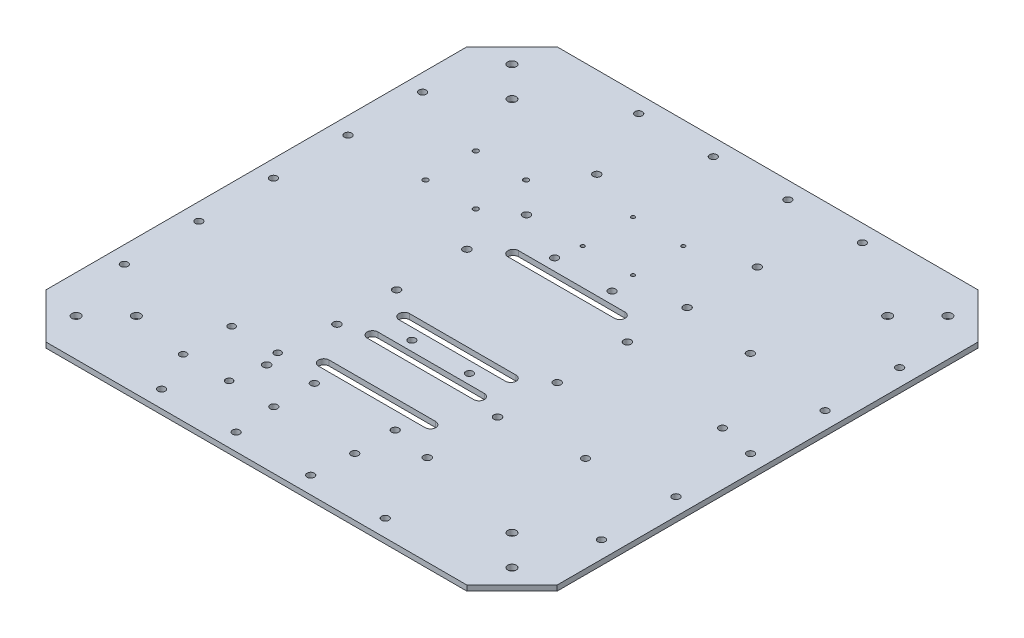
from build123d import *

# Parameters (mm, degrees)
BOSS_EXTRUDE1_DEPTH = 3.175
SKETCH2_R           = 2.159
CUT_EXTRUDE1_DEPTH  = 297.247830215
CUT_EXTRUDE2_DEPTH  = 297.247830215
SKETCH7_R           = 1.524
CUT_EXTRUDE3_DEPTH  = 297.247830215
SKETCH10_R          = 2.159
CUT_EXTRUDE6_DEPTH  = 297.247830215
SKETCH9_R           = 2.032
CUT_EXTRUDE5_DEPTH  = 297.247830215
SKETCH13_R          = 1.1
CUT_EXTRUDE8_DEPTH  = 297.247830215
SKETCH14_R          = 2.54
CUT_EXTRUDE9_DEPTH  = 297.247830215
SKETCH15_R          = 2.159
CUT_EXTRUDE10_DEPTH = 297.247830215
SKETCH16_R          = 2.159
CUT_EXTRUDE11_DEPTH = 297.247830215
SKETCH17_R          = 2.2225
CUT_EXTRUDE13_DEPTH = 297.247830215


with BuildPart() as part:
    # Sketch1 → Boss-Extrude1 (new body)
    with BuildSketch(Plane(origin=(0, 0, 0), x_dir=(1, 0, 0), z_dir=(0, 1, 0))):
        Polygon((-94.345284264, 72.258976948), (-121.286052627, 45.318208585), (-121.286052627, -205.600254688), (-94.345284264, -232.541023052), (156.573179009, -232.541023052), (183.513947373, -205.600254688), (183.513947373, 45.318208585), (156.573179009, 72.258976948), align=None)
    extrude(amount=BOSS_EXTRUDE1_DEPTH)

    # Sketch2 → Cut-Extrude1 (cut, through all)
    with BuildSketch(Plane(origin=(0, 3.175, 0), x_dir=(1, 0, 0), z_dir=(0, 1, 0))):
        with Locations(Location((13.841947373, -37.469023052, 0), (0, 0, 270))):
            Circle(SKETCH2_R)
        with Locations(Location((48.131947373, -37.469023052, 0), (0, 0, 270))):
            Circle(SKETCH2_R)
        with Locations(Location((13.841947373, -122.559023052, 0), (0, 0, 270))):
            Circle(SKETCH2_R)
        with Locations(Location((48.131947373, -122.559023052, 0), (0, 0, 270))):
            Circle(SKETCH2_R)
    extrude(amount=-CUT_EXTRUDE1_DEPTH, mode=Mode.SUBTRACT)

    # Sketch4 → Cut-Extrude2 (cut, through all)
    with BuildSketch(Plane(origin=(0, 3.175, 0), x_dir=(1, 0, 0), z_dir=(0, 1, 0))):
        with BuildLine():
            Line((-0.636052627, -44.466023052), (62.863947373, -44.466023052))
            ThreePointArc((62.863947373, -44.466023052), (66.038947373, -47.641023052), (62.863947373, -50.816023052))
            Line((62.863947373, -50.816023052), (-0.636052627, -50.816023052))
            ThreePointArc((-0.636052627, -50.816023052), (-3.811052627, -47.641023052), (-0.636052627, -44.466023052))
        make_face()
        with BuildLine():
            Line((-0.636052627, -109.466023052), (62.863947373, -109.466023052))
            ThreePointArc((62.863947373, -109.466023052), (66.038947373, -112.641023052), (62.863947373, -115.816023052))
            Line((62.863947373, -115.816023052), (-0.636052627, -115.816023052))
            ThreePointArc((-0.636052627, -115.816023052), (-3.811052627, -112.641023052), (-0.636052627, -109.466023052))
        make_face()
        with BuildLine():
            Line((-0.636052627, -128.401023052), (62.863947373, -128.401023052))
            ThreePointArc((62.863947373, -128.401023052), (66.038947373, -131.576023052), (62.863947373, -134.751023052))
            Line((62.863947373, -134.751023052), (-0.636052627, -134.751023052))
            ThreePointArc((-0.636052627, -134.751023052), (-3.811052627, -131.576023052), (-0.636052627, -128.401023052))
        make_face()
        with BuildLine():
            Line((-0.636052627, -157.401023052), (62.863947373, -157.401023052))
            ThreePointArc((62.863947373, -157.401023052), (66.038947373, -160.576023052), (62.863947373, -163.751023052))
            Line((62.863947373, -163.751023052), (-0.636052627, -163.751023052))
            ThreePointArc((-0.636052627, -163.751023052), (-3.811052627, -160.576023052), (-0.636052627, -157.401023052))
        make_face()
    extrude(amount=-CUT_EXTRUDE2_DEPTH, mode=Mode.SUBTRACT)

    # Sketch7 → Cut-Extrude3 (cut, through all)
    with BuildSketch(Plane(origin=(0, 3.175, 0), x_dir=(1, 0, 0), z_dir=(0, 1, 0))):
        with Locations(Location((-34.926052627, -5.719023052, 0), (0, 0, 270))):
            Circle(SKETCH7_R)
        with Locations(Location((-34.926052627, -35.691023052, 0), (0, 0, 270))):
            Circle(SKETCH7_R)
        with Locations(Location((-64.898052627, -35.691023052, 0), (0, 0, 90))):
            Circle(SKETCH7_R)
        with Locations(Location((-64.898052627, -5.719023052, 0), (0, 0, 90))):
            Circle(SKETCH7_R)
    extrude(amount=-CUT_EXTRUDE3_DEPTH, mode=Mode.SUBTRACT)

    # Sketch10 → Cut-Extrude6 (cut, through all)
    with BuildSketch(Plane.XZ):
        with Locations(Location((6.983947373, 198.041023052, 0), (0, 0, 270))):
            Circle(SKETCH10_R)
        with Locations(Location((55.243947373, 198.041023052, 0), (0, 0, 270))):
            Circle(SKETCH10_R)
        with Locations(Location((6.983947373, 173.911023052, 0), (0, 0, 270))):
            Circle(SKETCH10_R)
        with Locations(Location((55.243947373, 173.911023052, 0), (0, 0, 270))):
            Circle(SKETCH10_R)
    extrude(amount=-CUT_EXTRUDE6_DEPTH, mode=Mode.SUBTRACT)

    # Sketch9 → Cut-Extrude5 (cut, through all)
    with BuildSketch(Plane(origin=(0, 0, 0), x_dir=(-1, 0, 0), z_dir=(0, -1, 0))):
        with Locations(Location((47.118052627, -197.997023052, 0), (0, 0, 90))):
            Circle(SKETCH9_R)
        with Locations(Location((19.686052627, -197.997023052, 0), (0, 0, 270))):
            Circle(SKETCH9_R)
        with Locations(Location((47.118052627, -169.041023052, 0), (0, 0, 90))):
            Circle(SKETCH9_R)
        with Locations(Location((19.686052627, -169.041023052, 0), (0, 0, 270))):
            Circle(SKETCH9_R)
    extrude(amount=-CUT_EXTRUDE5_DEPTH, mode=Mode.SUBTRACT)

    # Sketch13 → Cut-Extrude8 (cut, through all)
    with BuildSketch(Plane.XZ):
        with Locations(Location((16.113947373, 22.991023052, 0), (0, 0, 270))):
            Circle(SKETCH13_R)
        with Locations(Location((16.113947373, -7.008976948, 0), (0, 0, 270))):
            Circle(SKETCH13_R)
        with Locations(Location((46.113947373, -7.008976948, 0), (0, 0, 90))):
            Circle(SKETCH13_R)
        with Locations(Location((46.113947373, 22.991023052, 0), (0, 0, 90))):
            Circle(SKETCH13_R)
    extrude(amount=-CUT_EXTRUDE8_DEPTH, mode=Mode.SUBTRACT)

    # Sketch14 → Cut-Extrude9 (cut, through all)
    with BuildSketch(Plane.XZ):
        with Locations(Location((-98.835412325, 210.090382749, 0), (0, 0, 270))):
            Circle(SKETCH14_R)
        with Locations(Location((-80.874900083, 192.129870507, 0), (0, 0, 270))):
            Circle(SKETCH14_R)
        with Locations(Location((143.102794828, 192.129870507, 0), (0, 0, 90))):
            Circle(SKETCH14_R)
        with Locations(Location((161.06330707, 210.090382749, 0), (0, 0, 90))):
            Circle(SKETCH14_R)
        with Locations(Location((-98.835412325, -49.808336646, 0), (0, 0, 90))):
            Circle(SKETCH14_R)
        with Locations(Location((-80.874900083, -31.847824404, 0), (0, 0, 90))):
            Circle(SKETCH14_R)
        with Locations(Location((161.06330707, -49.808336646, 0), (0, 0, 270))):
            Circle(SKETCH14_R)
        with Locations(Location((143.102794828, -31.847824404, 0), (0, 0, 270))):
            Circle(SKETCH14_R)
    extrude(amount=-CUT_EXTRUDE9_DEPTH, mode=Mode.SUBTRACT)

    # Sketch15 → Cut-Extrude10 (cut, through all)
    with BuildSketch(Plane.XZ):
        with Locations(Location((8.888947373, 222.381023052, 0), (0, 0, 270))):
            Circle(SKETCH15_R)
        with Locations(Location((-35.561052627, 222.381023052, 0), (0, 0, 270))):
            Circle(SKETCH15_R)
        with Locations(Location((-111.126052627, 80.141023052, 0), (0, 0, 270))):
            Circle(SKETCH15_R)
        with Locations(Location((-111.126052627, 124.591023052, 0), (0, 0, 270))):
            Circle(SKETCH15_R)
        with Locations(Location((-111.126052627, 169.041023052, 0), (0, 0, 270))):
            Circle(SKETCH15_R)
        with Locations(Location((173.353947373, 169.041023052, 0), (0, 0, 90))):
            Circle(SKETCH15_R)
        with Locations(Location((173.353947373, 124.591023052, 0), (0, 0, 90))):
            Circle(SKETCH15_R)
        with Locations(Location((173.353947373, 80.141023052, 0), (0, 0, 90))):
            Circle(SKETCH15_R)
        with Locations(Location((97.788947373, 222.381023052, 0), (0, 0, 90))):
            Circle(SKETCH15_R)
        with Locations(Location((53.338947373, 222.381023052, 0), (0, 0, 90))):
            Circle(SKETCH15_R)
        with Locations(Location((53.338947373, -62.098976948, 0), (0, 0, 270))):
            Circle(SKETCH15_R)
        with Locations(Location((97.788947373, -62.098976948, 0), (0, 0, 270))):
            Circle(SKETCH15_R)
        with Locations(Location((173.353947373, 35.691023052, 0), (0, 0, 270))):
            Circle(SKETCH15_R)
        with Locations(Location((173.353947373, -8.758976948, 0), (0, 0, 270))):
            Circle(SKETCH15_R)
        with Locations(Location((-111.126052627, -8.758976948, 0), (0, 0, 90))):
            Circle(SKETCH15_R)
        with Locations(Location((-111.126052627, 35.691023052, 0), (0, 0, 90))):
            Circle(SKETCH15_R)
        with Locations(Location((-35.561052627, -62.098976948, 0), (0, 0, 90))):
            Circle(SKETCH15_R)
        with Locations(Location((8.888947373, -62.098976948, 0), (0, 0, 90))):
            Circle(SKETCH15_R)
    extrude(amount=-CUT_EXTRUDE10_DEPTH, mode=Mode.SUBTRACT)

    # Sketch16 → Cut-Extrude11 (cut, through all)
    with BuildSketch(Plane(origin=(0, 0, 0), x_dir=(-1, 0, 0), z_dir=(0, -1, 0))):
        with Locations(Location((-126.617947373, -131.830023052, 0), (0, 0, 90))):
            Circle(SKETCH16_R)
        with Locations(Location((-121.537947373, -28.452023052, 0), (0, 0, 90))):
            Circle(SKETCH16_R)
        with Locations(Location((-151.763947373, -75.274023052, 0), (0, 0, 90))):
            Circle(SKETCH16_R)
    extrude(amount=-CUT_EXTRUDE11_DEPTH, mode=Mode.SUBTRACT)

    # Sketch17 → Cut-Extrude13 (cut, through all)
    with BuildSketch(Plane(origin=(0, 3.175, 0), x_dir=(1, 0, 0), z_dir=(0, 1, 0))):
        with Locations(Location((78.992947373, -178.566023052, 0), (0, 0, 270))):
            Circle(SKETCH17_R)
        with Locations(Location((-16.765052627, -178.566023052, 0), (0, 0, 270))):
            Circle(SKETCH17_R)
        with Locations(Location((78.992947373, -136.656023052, 0), (0, 0, 270))):
            Circle(SKETCH17_R)
        with Locations(Location((-16.765052627, -136.656023052, 0), (0, 0, 270))):
            Circle(SKETCH17_R)
        with Locations(Location((78.992947373, -101.096023052, 0), (0, 0, 270))):
            Circle(SKETCH17_R)
        with Locations(Location((-16.765052627, -101.096023052, 0), (0, 0, 270))):
            Circle(SKETCH17_R)
        with Locations(Location((78.992947373, -59.186023052, 0), (0, 0, 270))):
            Circle(SKETCH17_R)
        with Locations(Location((-16.765052627, -59.186023052, 0), (0, 0, 270))):
            Circle(SKETCH17_R)
        with Locations(Location((78.992947373, -23.626023052, 0), (0, 0, 270))):
            Circle(SKETCH17_R)
        with Locations(Location((-16.765052627, -23.626023052, 0), (0, 0, 270))):
            Circle(SKETCH17_R)
        with Locations(Location((78.992947373, 18.283976948, 0), (0, 0, 270))):
            Circle(SKETCH17_R)
        with Locations(Location((-16.765052627, 18.283976948, 0), (0, 0, 270))):
            Circle(SKETCH17_R)
    extrude(amount=-CUT_EXTRUDE13_DEPTH, mode=Mode.SUBTRACT)


solid = part.part
